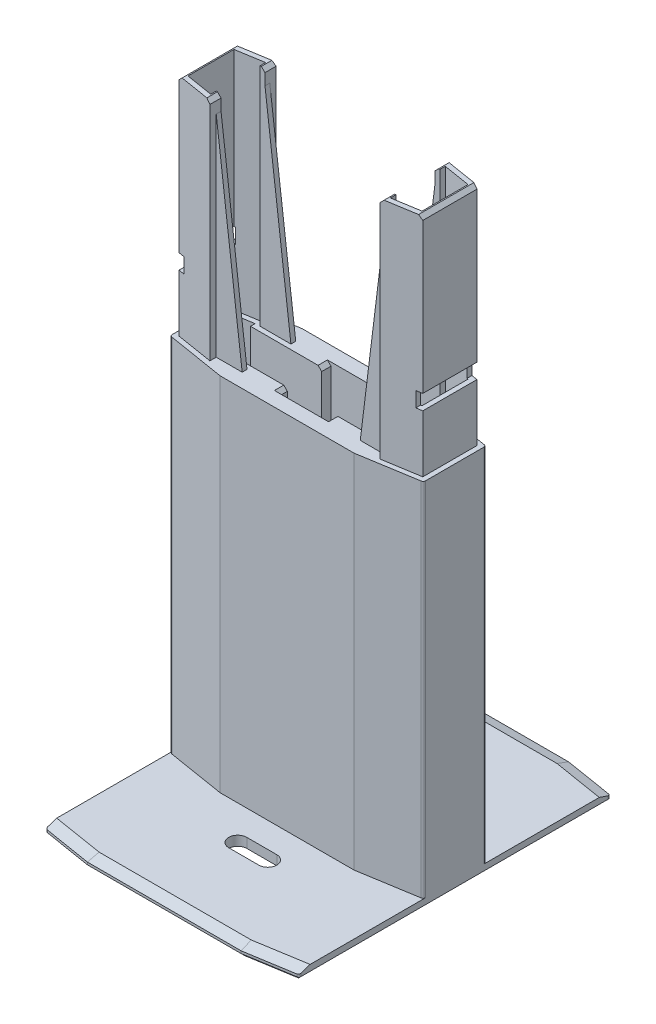
from build123d import *
from OCP.BRepFilletAPI import BRepFilletAPI_MakeChamfer

# Parameters (mm, degrees)
BOSS_EXTRUDE1_DEPTH     = 123.2
BOSS_EXTRUDE2_START     = 123.2
BOSS_EXTRUDE2_DEPTH     = 75
CUT_EXTRUDE1_DEPTH      = 204.077842218
CUT_EXTRUDE1_DEPTH_BACK = 204.077842218
SKETCH2_W               = 2
SKETCH2_H               = 5
CUT_EXTRUDE2_DEPTH      = 204.077842218
CUT_EXTRUDE2_DEPTH_BACK = 204.077842218
BOSS_EXTRUDE3_DEPTH     = 3.2
CUT_EXTRUDE3_DEPTH      = 205.334554102
CUT_EXTRUDE3_DEPTH_BACK = 205.334554102
BOSS_EXTRUDE4_DEPTH     = 3.2
BOSS_EXTRUDE5_DEPTH     = 3.2
CUT_EXTRUDE4_DEPTH      = 3.2
CHAMFER1_SIZE           = 1.2
CHAMFER1_SIZE2          = 3.6
CHAMFER2_SIZE           = 1.2
FILLET1_R               = 0.8


with BuildPart() as part:
    # Sketch1 → Boss-Extrude1 (new body)
    with BuildSketch(Plane(origin=(0, 0, 0), x_dir=(1, 0, 0), z_dir=(0, 1, 0))):
        Polygon((-22.25475327, 13.6), (22.25475327, 13.6), (42.1, 10.359959718), (42.1, -10.359959718), (22.25475327, -13.6), (-22.25475327, -13.6), (-42.1, -10.359959718), (-42.1, 10.359959718), align=None)
    extrude(amount=BOSS_EXTRUDE1_DEPTH)

    # Sketch1<3> → Boss-Extrude2 (add)
    with BuildSketch(Plane(origin=(0, 0, 0), x_dir=(1, 0, 0), z_dir=(0, 1, 0)).offset(BOSS_EXTRUDE2_START)):
        Polygon((40.5, -9), (28.25, -11), (28.25, -8.9), (11, -8.9), (11, -12), (-11, -12), (-11, -8.9), (-28.25, -8.9), (-28.25, -11), (-40.5, -9), (-40.5, 9), (-28.25, 11), (-28.25, 8.9), (-11, 8.9), (-11, 12), (11, 12), (11, 8.9), (28.25, 8.9), (28.25, 11), (40.5, 9), align=None)
        Polygon((-38.9, -7.640040282), (-29.85, -9.117591303), (-29.85, -7.3), (-9.4, -7.3), (-9.4, -10.4), (9.4, -10.4), (9.4, -7.3), (29.85, -7.3), (29.85, -9.117591303), (38.9, -7.640040282), (38.9, 7.640040282), (29.85, 9.117591303), (29.85, 7.3), (9.4, 7.3), (9.4, 10.4), (-9.4, 10.4), (-9.4, 7.3), (-29.85, 7.3), (-29.85, 9.117591303), (-38.9, 7.640040282), align=None, mode=Mode.SUBTRACT)
    extrude(amount=BOSS_EXTRUDE2_DEPTH)

    # Sketch2 → Cut-Extrude1 (cut, two sides: drawn at the far end of the back side and taken through both)
    with BuildSketch(Plane.XY.offset(-CUT_EXTRUDE1_DEPTH_BACK)):
        with Locations((-39.5, 144.7)):
            Rectangle(SKETCH2_W, SKETCH2_H)
        with Locations((39.5, 144.7)):
            Rectangle(SKETCH2_W, SKETCH2_H)
    extrude(amount=CUT_EXTRUDE1_DEPTH + CUT_EXTRUDE1_DEPTH_BACK, mode=Mode.SUBTRACT)

    # Sketch3 → Cut-Extrude2 (cut, two sides: drawn at the far end of the back side and taken through both)
    with BuildSketch(Plane.XY.offset(-CUT_EXTRUDE2_DEPTH_BACK)):
        Polygon((-28.25, 193.2), (-19.625, 123.2), (19.625, 123.2), (28.25, 193.2), (28.25, 198.2), (-28.25, 198.2), align=None)
    extrude(amount=CUT_EXTRUDE2_DEPTH + CUT_EXTRUDE2_DEPTH_BACK, mode=Mode.SUBTRACT)

    # Sketch4 → Boss-Extrude3 (add)
    with BuildSketch(Plane(origin=(0, 0, 0), x_dir=(1, 0, 0), z_dir=(0, 1, 0))):
        Polygon((23.292779429, 26.4), (42.1, 23.329433376), (42.1, -23.329433376), (23.292779429, -26.4), (-23.292779429, -26.4), (-42.1, -23.329433376), (-42.1, 23.329433376), (-23.292779429, 26.4), align=None)
    extrude(amount=BOSS_EXTRUDE3_DEPTH)

    # Sketch1<4> → Cut-Extrude3 (cut, two sides: drawn at the far end of the back side and taken through both)
    with BuildSketch(Plane(origin=(0, 0, 0), x_dir=(1, 0, 0), z_dir=(0, 1, 0)).offset(-CUT_EXTRUDE3_DEPTH_BACK)):
        Polygon((-31.45, -5.7), (-7.8, -5.7), (-7.8, -8.8), (7.8, -8.8), (7.8, -5.7), (31.45, -5.7), (31.45, -7.235182606), (37.3, -6.280080565), (37.3, 6.280080565), (31.45, 7.235182606), (31.45, 5.7), (7.8, 5.7), (7.8, 8.8), (-7.8, 8.8), (-7.8, 5.7), (-31.45, 5.7), (-31.45, 7.235182606), (-37.3, 6.280080565), (-37.3, -6.280080565), (-31.45, -7.235182606), align=None)
    extrude(amount=CUT_EXTRUDE3_DEPTH + CUT_EXTRUDE3_DEPTH_BACK, mode=Mode.SUBTRACT)

    # Sketch5 → Boss-Extrude4 (add)
    with BuildSketch(Plane(origin=(0, 0, 0), x_dir=(1, 0, 0), z_dir=(0, 1, 0))):
        Polygon((23.292779429, 26.4), (42.1, 23.329433376), (42.1, 51.700157004), (25.563461651, 54.4), (-25.563461651, 54.4), (-42.1, 51.700157004), (-42.1, 23.329433376), (-23.292779429, 26.4), align=None)
        Polygon((-42.1, -23.329433376), (-42.1, -51.700157004), (-25.563461651, -54.4), (25.563461651, -54.4), (42.1, -51.700157004), (42.1, -23.329433376), (23.292779429, -26.4), (-23.292779429, -26.4), align=None)
    extrude(amount=BOSS_EXTRUDE4_DEPTH)

    # Sketch6 → Boss-Extrude5 (add)
    with BuildSketch(Plane(origin=(0, 0, 0), x_dir=(1, 0, 0), z_dir=(0, 1, 0))):
        Polygon((25.563461651, 54.4), (42.1, 51.700157004), (42.1, 48.100157004), (-42.1, 48.100157004), (-42.1, 51.700157004), (-25.563461651, 54.4), align=None)
        Polygon((42.1, -48.100157004), (42.1, -51.700157004), (25.563461651, -54.4), (-25.563461651, -54.4), (-42.1, -51.700157004), (-42.1, -48.100157004), align=None)
    extrude(amount=BOSS_EXTRUDE5_DEPTH)

    # Sketch7 → Cut-Extrude4 (cut)
    with BuildSketch(Plane(origin=(0, 0, 0), x_dir=(0, 0, -1), z_dir=(0, 1, 0))):
        with BuildLine():
            Line((28, -5), (28, 5))
            ThreePointArc((28, 5), (25, 8), (22, 5))
            Line((22, 5), (22, -5))
            ThreePointArc((22, -5), (25, -8), (28, -5))
        make_face()
        with BuildLine():
            Line((-28, -5), (-28, 5))
            ThreePointArc((-28, 5), (-25, 8), (-22, 5))
            Line((-22, 5), (-22, -5))
            ThreePointArc((-22, -5), (-25, -8), (-28, -5))
        make_face()
    extrude(amount=CUT_EXTRUDE4_DEPTH, mode=Mode.SUBTRACT)

    # Chamfer1: one chamfer whose edges measure the first distance from different faces: ONE call of the kernel's chamfer builder (chamfer() names one face for all edges)
    chamfer1_edges_1 = [part.edges().sort_by_distance(p)[0] for p in [
        (-33.831730825, 3.2, 53.050078502),
    ]]
    chamfer1_side_1 = [part.faces().sort_by_distance(p)[0] for p in [
        (-33.831730825, 1.6, 53.050078502),
    ]]
    chamfer1_edges_2 = [part.edges().sort_by_distance(p)[0] for p in [
        (0, 3.2, 54.4),
    ]]
    chamfer1_side_2 = [part.faces().sort_by_distance(p)[0] for p in [
        (0, 1.6, 54.4),
    ]]
    chamfer1_edges_3 = [part.edges().sort_by_distance(p)[0] for p in [
        (33.831730825, 3.2, 53.050078502),
    ]]
    chamfer1_side_3 = [part.faces().sort_by_distance(p)[0] for p in [
        (33.831730825, 1.6, 53.050078502),
    ]]
    chamfer1_edges_4 = [part.edges().sort_by_distance(p)[0] for p in [
        (33.831730825, 3.2, -53.050078502),
    ]]
    chamfer1_side_4 = [part.faces().sort_by_distance(p)[0] for p in [
        (33.831730825, 1.6, -53.050078502),
    ]]
    chamfer1_edges_5 = [part.edges().sort_by_distance(p)[0] for p in [
        (0, 3.2, -54.4),
    ]]
    chamfer1_side_5 = [part.faces().sort_by_distance(p)[0] for p in [
        (0, 1.6, -54.4),
    ]]
    chamfer1_edges_6 = [part.edges().sort_by_distance(p)[0] for p in [
        (-33.831730825, 3.2, -53.050078502),
    ]]
    chamfer1_side_6 = [part.faces().sort_by_distance(p)[0] for p in [
        (-33.831730825, 1.6, -53.050078502),
    ]]
    chamfer1 = BRepFilletAPI_MakeChamfer(part.part.solid().wrapped)
    for e in chamfer1_edges_1:
        chamfer1.Add(CHAMFER1_SIZE, CHAMFER1_SIZE2, e.wrapped, chamfer1_side_1[0].wrapped)  # the first distance lies on this face
    for e in chamfer1_edges_2:
        chamfer1.Add(CHAMFER1_SIZE, CHAMFER1_SIZE2, e.wrapped, chamfer1_side_2[0].wrapped)  # the first distance lies on this face
    for e in chamfer1_edges_3:
        chamfer1.Add(CHAMFER1_SIZE, CHAMFER1_SIZE2, e.wrapped, chamfer1_side_3[0].wrapped)  # the first distance lies on this face
    for e in chamfer1_edges_4:
        chamfer1.Add(CHAMFER1_SIZE, CHAMFER1_SIZE2, e.wrapped, chamfer1_side_4[0].wrapped)  # the first distance lies on this face
    for e in chamfer1_edges_5:
        chamfer1.Add(CHAMFER1_SIZE, CHAMFER1_SIZE2, e.wrapped, chamfer1_side_5[0].wrapped)  # the first distance lies on this face
    for e in chamfer1_edges_6:
        chamfer1.Add(CHAMFER1_SIZE, CHAMFER1_SIZE2, e.wrapped, chamfer1_side_6[0].wrapped)  # the first distance lies on this face
    add(Compound.cast(chamfer1.Shape()), mode=Mode.REPLACE)

    # Chamfer2
    chamfer2_edges = [part.edges().sort_by_distance(p)[0] for p in [
        (-42.1, 0, 0),
        (-7.8, 123.2, 7.25),
        (7.8, 123.2, 7.25),
        (7.8, 123.2, -7.25),
        (-7.8, 123.2, -7.25),
        (-7.8, 0, -7.25),
        (7.8, 0, -7.25),
        (7.8, 0, 7.25),
        (-7.8, 0, 7.25),
        (40.5, 198.2, 0),
        (28.25, 198.2, -9.15),
        (-28.25, 198.2, 9.15),
        (0, 0, 54.4),
        (33.831730825, 0, 53.050078502),
        (-33.831730825, 0, 53.050078502),
        (33.831730825, 0, -53.050078502),
        (0, 0, -54.4),
        (-33.831730825, 0, -53.050078502),
        (28.25, 198.2, 9.15),
        (-28.25, 198.2, -9.15),
        (-40.5, 198.2, 0),
        (42.1, 0, 0),
    ]]
    chamfer(chamfer2_edges, length=CHAMFER2_SIZE)

    # Fillet1
    fillet1_edges = [part.edges().sort_by_distance(p)[0] for p in [
        (-42.1, 63.2, 10.359959718),
        (42.1, 63.2, 10.359959718),
        (42.1, 63.2, -10.359959718),
        (-42.1, 63.2, -10.359959718),
        (-42.1, 1.6, 51.700157004),
        (-42.1, 1.6, -51.700157004),
        (42.1, 1.6, -51.700157004),
        (42.1, 1.6, 51.700157004),
    ]]
    fillet(fillet1_edges, radius=FILLET1_R)


solid = part.part
